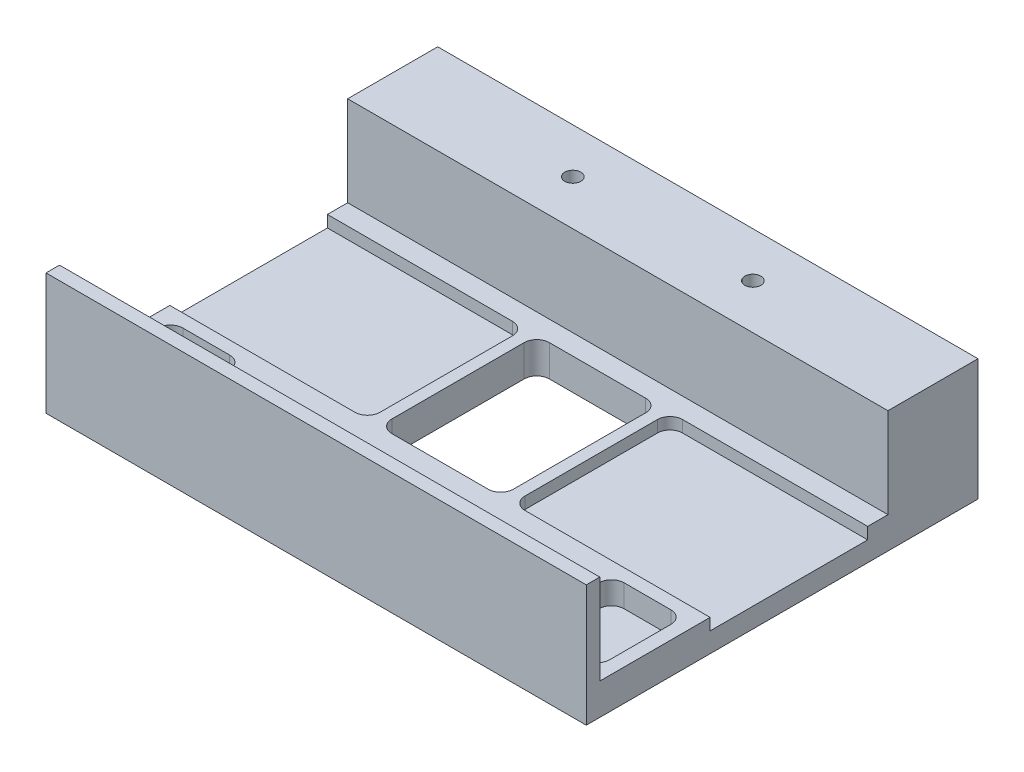
from build123d import *

# Parameters (mm, degrees)
SKETCH1_W                   = 76.2
SKETCH1_H                   = 44.45
BOSS_EXTRUDE1_DEPTH         = 4.445
SKETCH2_W                   = 76.2
SKETCH2_H                   = 1.905
BOSS_EXTRUDE2_DEPTH         = 12.7
CUT_EXTRUDE3_DEPTH          = 46.900442536
SKETCH7_W                   = 27.8765
SKETCH7_H                   = 22.225
CUT_EXTRUDE4_DEPTH          = 1.651
SKETCH11_W                  = 10.16
SKETCH11_H                  = 12.192
CUT_EXTRUDE6_DEPTH          = 3.175
SKETCH13_W                  = 76.2
SKETCH13_H                  = 17.145
BOSS_EXTRUDE3_DEPTH         = 12.7
FILLET1_R                   = 1.778
F_1_4_20_TAPPED_HOLE1_D     = 5.1054
F_1_4_20_TAPPED_HOLE1_DEPTH = 6.35
F_1_4_20_TAPPED_HOLE1_TIP   = 1.533816902
F_4_40_TAPPED_HOLE1_D       = 2.2606
F_4_40_TAPPED_HOLE1_DEPTH   = 6.35
F_4_40_TAPPED_HOLE1_TIP     = 0.679152758


with BuildPart() as part:
    # Sketch1 → Boss-Extrude1 (new body)
    with BuildSketch(Plane(origin=(0, 0, 0), x_dir=(1, 0, 0), z_dir=(0, 1, 0))):
        Rectangle(SKETCH1_W, SKETCH1_H)
    extrude(amount=BOSS_EXTRUDE1_DEPTH)

    # Sketch2 → Boss-Extrude2 (add)
    with BuildSketch(Plane(origin=(0, 4.445, 0), x_dir=(1, 0, 0), z_dir=(0, 1, 0))):
        with Locations((0, 21.2725)):
            Rectangle(SKETCH2_W, SKETCH2_H)
        with Locations((0, -21.2725)):
            Rectangle(SKETCH2_W, SKETCH2_H)
    extrude(amount=BOSS_EXTRUDE2_DEPTH)

    # Sketch6 → Cut-Extrude3 (cut, through all)
    with BuildSketch(Plane(origin=(0, 4.445, 0), x_dir=(1, 0, 0), z_dir=(0, 1, 0))):
        with BuildLine():
            Line((-8.5725, 15.6845), (-8.5725, -2.9845))
            ThreePointArc((-8.5725, -2.9845), (-8.051735857, -4.241735857), (-6.7945, -4.7625))
            Line((-6.7945, -4.7625), (6.7945, -4.7625))
            ThreePointArc((6.7945, -4.7625), (8.051735857, -4.241735857), (8.5725, -2.9845))
            Line((8.5725, -2.9845), (8.5725, 15.6845))
            ThreePointArc((8.5725, 15.6845), (8.051735857, 16.941735857), (6.7945, 17.4625))
            Line((6.7945, 17.4625), (-6.7945, 17.4625))
            ThreePointArc((-6.7945, 17.4625), (-8.051735857, 16.941735857), (-8.5725, 15.6845))
        make_face()
    extrude(amount=-CUT_EXTRUDE3_DEPTH, mode=Mode.SUBTRACT)

    # Sketch7 → Cut-Extrude4 (cut)
    with BuildSketch(Plane(origin=(0, 4.445, 0), x_dir=(1, 0, 0), z_dir=(0, 1, 0))):
        with Locations((-24.16175, 6.35)):
            Rectangle(SKETCH7_W, SKETCH7_H)
        with Locations((24.16175, 6.35)):
            Rectangle(SKETCH7_W, SKETCH7_H)
    extrude(amount=-CUT_EXTRUDE4_DEPTH, mode=Mode.SUBTRACT)

    # Sketch11 → Cut-Extrude6 (cut)
    with BuildSketch(Plane(origin=(0, 4.445, 0), x_dir=(1, 0, 0), z_dir=(0, 1, 0))):
        with Locations((-31.115, -12.7)):
            Rectangle(SKETCH11_W, SKETCH11_H)
        with Locations((31.115, -12.7)):
            Rectangle(SKETCH11_W, SKETCH11_H)
    extrude(amount=-CUT_EXTRUDE6_DEPTH, mode=Mode.SUBTRACT)

    # Sketch13 → Boss-Extrude3 (add)
    with BuildSketch(Plane.XY.offset(-20.32)):
        with Locations((0, 8.5725)):
            Rectangle(SKETCH13_W, SKETCH13_H)
    extrude(amount=-BOSS_EXTRUDE3_DEPTH)

    # Fillet1
    fillet1_edges = [part.edges().sort_by_distance(p)[0] for p in [
        (-36.195, 2.8575, 6.604),
        (-26.035, 2.8575, 6.604),
        (26.035, 2.8575, 18.796),
        (36.195, 2.8575, 18.796),
        (26.035, 2.8575, 6.604),
        (36.195, 2.8575, 6.604),
        (-36.195, 2.8575, 18.796),
        (-26.035, 2.8575, 18.796),
        (-10.2235, 3.6195, 4.7625),
        (-10.2235, 3.6195, -17.4625),
        (10.2235, 3.6195, -17.4625),
        (10.2235, 3.6195, 4.7625),
    ]]
    fillet(fillet1_edges, radius=FILLET1_R)

    # 1/4-20 Tapped Hole1
    with Locations(Plane(origin=(0, 0, -33.02), x_dir=(-1, 0, 0), z_dir=(0, 0, -1))):
        with Locations((-25.4, 8.89), (25.4, 8.89)):
            Hole(F_1_4_20_TAPPED_HOLE1_D / 2, depth=F_1_4_20_TAPPED_HOLE1_DEPTH)
            with Locations((0, 0, -(F_1_4_20_TAPPED_HOLE1_DEPTH + F_1_4_20_TAPPED_HOLE1_TIP / 2))):  # 118° drill point
                Cone(0, F_1_4_20_TAPPED_HOLE1_D / 2, F_1_4_20_TAPPED_HOLE1_TIP, mode=Mode.SUBTRACT)

    # #4-40 Tapped Hole1
    with Locations(Plane(origin=(0, 17.145, 0), x_dir=(-1, 0, 0), z_dir=(0, 1, 0))):
        with Locations((12.7, -26.67), (-12.7, -26.67)):
            Hole(F_4_40_TAPPED_HOLE1_D / 2, depth=F_4_40_TAPPED_HOLE1_DEPTH)
            with Locations((0, 0, -(F_4_40_TAPPED_HOLE1_DEPTH + F_4_40_TAPPED_HOLE1_TIP / 2))):  # 118° drill point
                Cone(0, F_4_40_TAPPED_HOLE1_D / 2, F_4_40_TAPPED_HOLE1_TIP, mode=Mode.SUBTRACT)


solid = part.part
